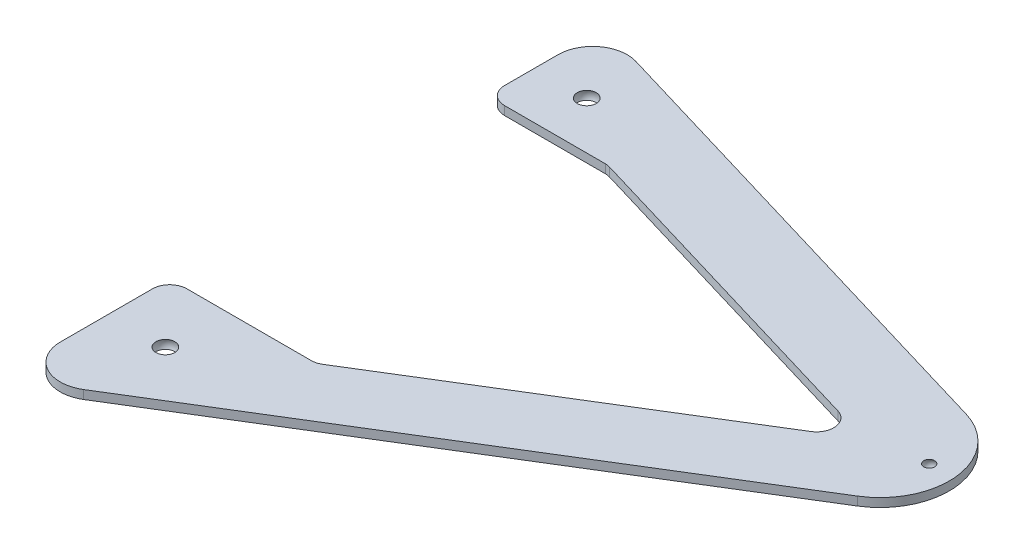
from build123d import *

# Parameters (mm, degrees)
ESTRUSIONE_ESTRUSIONE1_DEPTH = 5
RACCORDO1_R                  = 20
RACCORDO2_R                  = 40
TAGLIO_ESTRUSIONE1_DEPTH     = 474.530747945
RACCORDO3_R                  = 10


with BuildPart() as part:
    # Schizzo2 → Estrusione-Estrusione1 (new body)
    with BuildSketch(Plane(origin=(0, 0, 0), x_dir=(1, 0, 0), z_dir=(0, 1, 0))):
        Polygon((0, 0), (0, 350), (383.325939, 235.714285714), align=None)
    extrude(amount=ESTRUSIONE_ESTRUSIONE1_DEPTH)


with BuildPart() as body_2:
    # Schizzo7 → Rivoluzione4 (revolve)
    with BuildSketch(Plane(origin=(0, 2.5, 0), x_dir=(1, 0, 0), z_dir=(0, 1, 0))):
        with BuildLine():
            Line((311.744565165, 229.750776405), (311.744565165, 221.750776405))
            ThreePointArc((311.744565165, 221.750776405), (315.744565165, 225.750776405), (311.744565165, 229.750776405))
        make_face()
    revolve(axis=Axis((311.744565165, 2.5, -229.750776405), (0, 0, 1)))


with BuildPart() as body_3:
    # Schizzo9 → Rivoluzione5 (revolve)
    with BuildSketch(Plane(origin=(0, 2.5, 0), x_dir=(1, 0, 0), z_dir=(0, 1, 0))):
        with BuildLine():
            Line((30, 315.750776405), (30, 303.750776405))
            ThreePointArc((30, 303.750776405), (24, 309.750776405), (30, 315.750776405))
        make_face()
    revolve(axis=Axis((30, 2.5, -315.750776405), (0, 0, 1)))


with BuildPart() as body_4:
    # Schizzo11 → Rivoluzione6 (revolve)
    with BuildSketch(Plane(origin=(0, 2.5, 0), x_dir=(1, 0, 0), z_dir=(0, 1, 0))):
        with BuildLine():
            Line((35.083167937, 69.147081995), (30.669927062, 57.988080921))
            ThreePointArc((30.669927062, 57.988080921), (27.297046962, 65.774201896), (35.083167937, 69.147081995))
        make_face()
    revolve(axis=Axis((35.083167937, 2.5, -69.147081995), (-0.3677700729978802, 0, 0.9299167561707521)))


with BuildPart() as part_1:
    add(part.part)

    # Abbina1: cut body 4, body 2, body 3
    add(body_4.part, mode=Mode.SUBTRACT)
    add(body_2.part, mode=Mode.SUBTRACT)
    add(body_3.part, mode=Mode.SUBTRACT)

    # Raccordo1
    raccordo1_edges = [part_1.edges().sort_by_distance(p)[0] for p in [
        (0, 2.5, 0),
        (0, 2.5, -350),
    ]]
    fillet(raccordo1_edges, radius=RACCORDO1_R)

    # Raccordo2
    raccordo2_edges = [part_1.edges().sort_by_distance(p)[0] for p in [
        (383.325939, 2.5, -235.714285714),
    ]]
    fillet(raccordo2_edges, radius=RACCORDO2_R)

    # Schizzo12 → Taglio-Estrusione1 (cut, through all)
    with BuildSketch(Plane(origin=(0, 5, 0), x_dir=(1, 0, 0), z_dir=(0, 1, 0))):
        Polygon((69.639529693, 282.280076164), (280.468796143, 219.422933307), (84.546649543, 98.946742831), (-35.502330338, 98.946742831), (-35.502330338, 282.280076164), align=None)
    extrude(amount=-TAGLIO_ESTRUSIONE1_DEPTH, mode=Mode.SUBTRACT)

    # Raccordo3
    raccordo3_edges = [part_1.edges().sort_by_distance(p)[0] for p in [
        (280.468796143, 2.5, -219.422933307),
        (0, 2.5, -98.946742831),
        (84.546649543, 2.5, -98.946742831),
        (69.639529693, 2.5, -282.280076164),
        (0, 2.5, -282.280076164),
    ]]
    fillet(raccordo3_edges, radius=RACCORDO3_R)


solid = part_1.part
